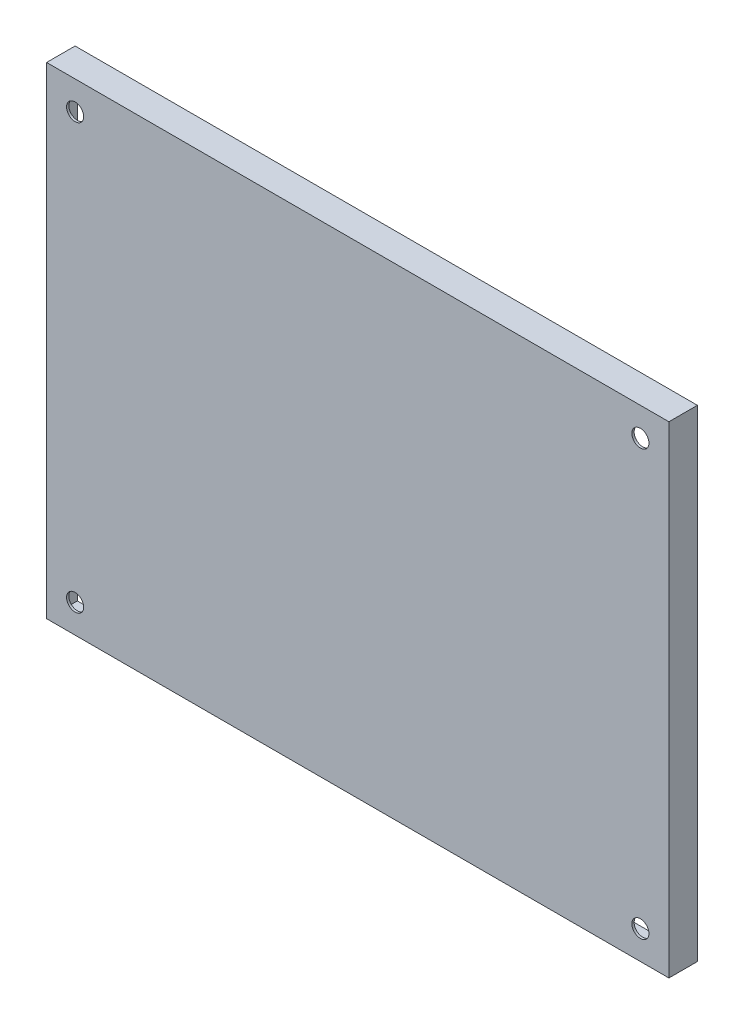
from build123d import *

# Parameters (mm, degrees)
SKETCH_1_W          = 327.6
SKETCH_1_H          = 253.6
EXTRUDE_1_DEPTH     = 15
SHELL_1_T           = -1.2
SKETCH_2_R          = 4.5
CUT_EXTRUDE_1_DEPTH = 15


with BuildPart() as part:
    # 草图1 → 凸台-拉伸1 (new body)
    with BuildSketch(Plane.XY):
        Rectangle(SKETCH_1_W, SKETCH_1_H)
    extrude(amount=EXTRUDE_1_DEPTH)

    # 抽壳1
    shell_1_openings = [part.faces().sort_by_distance(p)[0] for p in [
        (0, 0, 0),
    ]]
    offset(amount=SHELL_1_T, openings=shell_1_openings, kind=Kind.INTERSECTION)

    # 草图2 → 切除-拉伸1 (cut)
    with BuildSketch(Plane.XY.offset(15)):
        with Locations((-148.8, 111.8)):
            Circle(SKETCH_2_R)
        with Locations(Location((148.8, 111.8, 0), (0, 0, 180))):
            Circle(SKETCH_2_R)
        with Locations((148.8, -111.8)):
            Circle(SKETCH_2_R)
        with Locations(Location((-148.8, -111.8, 0), (0, 0, 180))):
            Circle(SKETCH_2_R)
    extrude(amount=-CUT_EXTRUDE_1_DEPTH, mode=Mode.SUBTRACT)


solid = part.part
